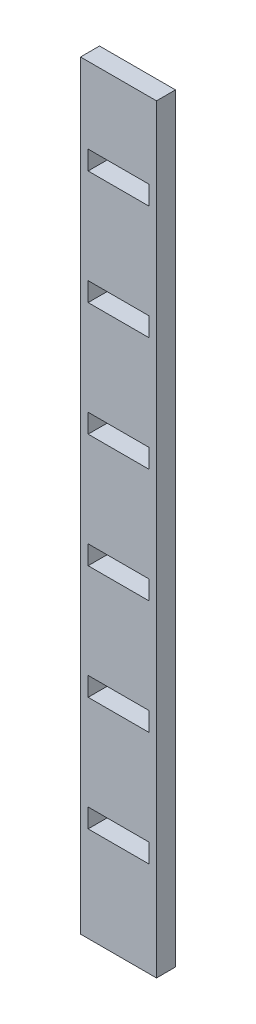
from build123d import *

# Parameters (mm, degrees)
SKETCH_1_W      = 200
SKETCH_1_H      = 2000
SKETCH_1_W_2    = 160
SKETCH_1_H_2    = 50
EXTRUDE_1_DEPTH = 50


with BuildPart() as part:
    # 草图1 → 凸台-拉伸1 (new body)
    with BuildSketch(Plane.XY):
        with Locations((0, 1000)):
            Rectangle(SKETCH_1_W, SKETCH_1_H)
        with Locations((0, 275)):
            Rectangle(SKETCH_1_W_2, SKETCH_1_H_2, mode=Mode.SUBTRACT)
        with Locations((0, 575)):
            Rectangle(SKETCH_1_W_2, SKETCH_1_H_2, mode=Mode.SUBTRACT)
        with Locations((0, 875)):
            Rectangle(SKETCH_1_W_2, SKETCH_1_H_2, mode=Mode.SUBTRACT)
        with Locations((0, 1175)):
            Rectangle(SKETCH_1_W_2, SKETCH_1_H_2, mode=Mode.SUBTRACT)
        with Locations((0, 1475)):
            Rectangle(SKETCH_1_W_2, SKETCH_1_H_2, mode=Mode.SUBTRACT)
        with Locations((0, 1775)):
            Rectangle(SKETCH_1_W_2, SKETCH_1_H_2, mode=Mode.SUBTRACT)
    extrude(amount=EXTRUDE_1_DEPTH)


solid = part.part
